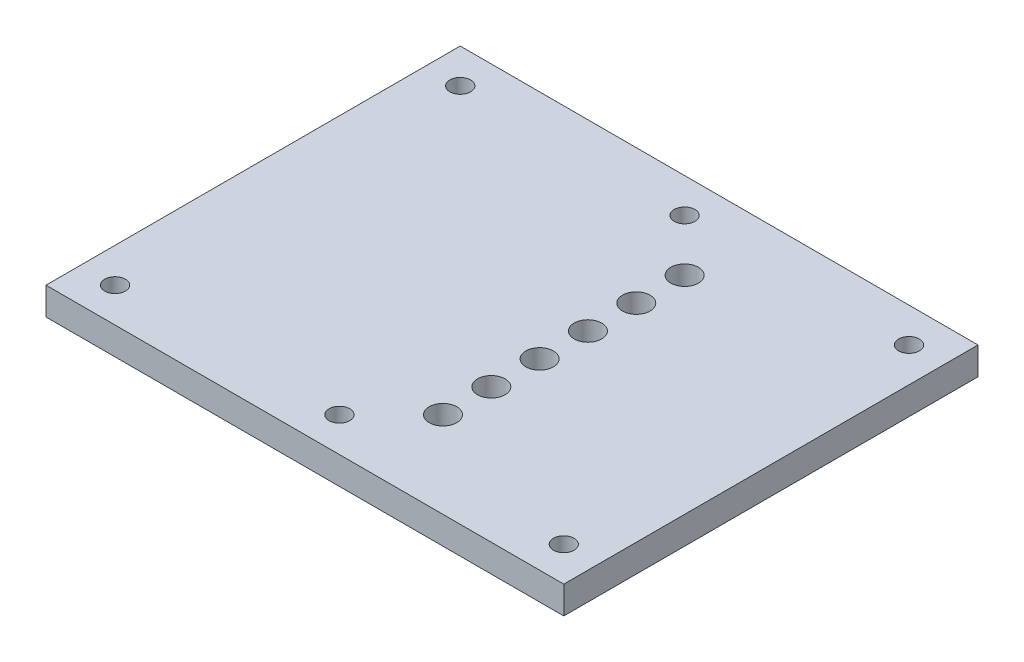
from build123d import *

# Parameters (mm, degrees)
SKETCH_1_W          = 75
SKETCH_1_H          = 60
EXTRUDE_1_DEPTH     = 4
SKETCH_2_R          = 2
CUT_EXTRUDE_1_DEPTH = 4
SKETCH_3_R          = 1.5
CUT_EXTRUDE_2_DEPTH = 49.189729196


with BuildPart() as part:
    # 草图1 → 凸台-拉伸1 (new body)
    with BuildSketch(Plane(origin=(0, 0, 0), x_dir=(1, 0, 0), z_dir=(0, 1, 0))):
        Rectangle(SKETCH_1_W, SKETCH_1_H)
    extrude(amount=EXTRUDE_1_DEPTH)

    # 草图2 → 切除-拉伸1 (cut)
    with BuildSketch(Plane(origin=(0, 0, 0), x_dir=(1, 0, 0), z_dir=(0, 1, 0))):
        with Locations(Location((7.5, 17.5, 0), (0, 0, 270))):
            Circle(SKETCH_2_R)
        with Locations(Location((7.5, 10.5, 0), (0, 0, 270))):
            Circle(SKETCH_2_R)
        with Locations(Location((7.5, 3.5, 0), (0, 0, 270))):
            Circle(SKETCH_2_R)
        with Locations(Location((7.5, -3.5, 0), (0, 0, 270))):
            Circle(SKETCH_2_R)
        with Locations(Location((7.5, -10.5, 0), (0, 0, 270))):
            Circle(SKETCH_2_R)
        with Locations(Location((7.5, -17.5, 0), (0, 0, 270))):
            Circle(SKETCH_2_R)
    extrude(amount=CUT_EXTRUDE_1_DEPTH, mode=Mode.SUBTRACT)

    # 草图3 → 切除-拉伸2 (cut, through all)
    with BuildSketch(Plane(origin=(0, 0, 0), x_dir=(1, 0, 0), z_dir=(0, 1, 0))):
        with Locations(Location((-32.5, 25, 0), (0, 0, 270))):
            Circle(SKETCH_3_R)
        with Locations(Location((32.5, 25, 0), (0, 0, 90))):
            Circle(SKETCH_3_R)
        with Locations(Location((32.5, -25, 0), (0, 0, 270))):
            Circle(SKETCH_3_R)
        with Locations(Location((-32.5, -25, 0), (0, 0, 90))):
            Circle(SKETCH_3_R)
        with Locations(Location((0, -25, 0), (0, 0, 90))):
            Circle(SKETCH_3_R)
        with Locations(Location((0, 25, 0), (0, 0, 270))):
            Circle(SKETCH_3_R)
    extrude(amount=CUT_EXTRUDE_2_DEPTH, mode=Mode.SUBTRACT)


solid = part.part
